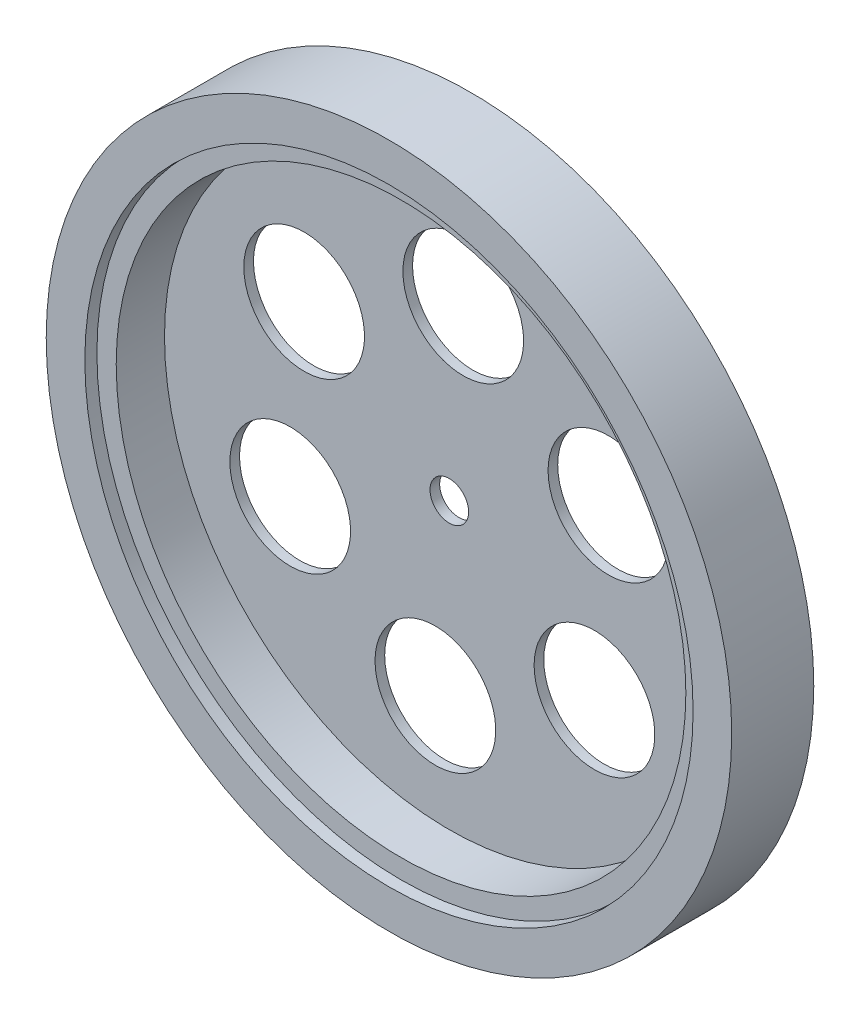
from build123d import *

# Parameters (mm, degrees)
SKETCH1_R                = 33
SKETCH1_R_2              = 29.5
BOSS_EXTRUDE1_DEPTH      = 6
SKETCH2_R                = 33
SKETCH2_R_2              = 2
BOSS_EXTRUDE2_DEPTH      = 1
SKETCH3_R                = 6.25
CUT_EXTRUDE2_DEPTH       = 7
CIRPATTERN1_COUNT        = 6
BOSS_EXTRUDE3_DEPTH      = 1.25
BOSS_EXTRUDE3_DEPTH_BACK = 7.25
SKETCH4_R                = 35.5
SKETCH4_R_2              = 31.5


with BuildPart() as part:
    # Sketch1 → Boss-Extrude1 (new body)
    with BuildSketch(Plane.XY):
        Circle(SKETCH1_R)
        Circle(SKETCH1_R_2, mode=Mode.SUBTRACT)
    extrude(amount=BOSS_EXTRUDE1_DEPTH)

    # Sketch2 → Boss-Extrude2 (add)
    with BuildSketch(Plane(origin=(0, 0, 0), x_dir=(-1, 0, 0), z_dir=(0, 0, -1))):
        with Locations(Location((0, 0, 0), (0, 0, 180))):
            Circle(SKETCH2_R)
        Circle(SKETCH2_R_2, mode=Mode.SUBTRACT)
    extrude(amount=-BOSS_EXTRUDE2_DEPTH)

    # Sketch3 → Cut-Extrude2 (cut)
    with BuildSketch(Plane(origin=(0, 0, 0), x_dir=(-1, 0, 0), z_dir=(0, 0, -1))):
        with Locations((1.444237573, -18.192764436)):
            Circle(SKETCH3_R)
    cut_extrude2 = extrude(amount=-CUT_EXTRUDE2_DEPTH, mode=Mode.SUBTRACT)

    # CirPattern1: Cut-Extrude2 ×6 about axis
    cirpattern1_axis = Axis((0, 0, 0), (0, 0, 1))
    for i in range(1, CIRPATTERN1_COUNT):
        add(cut_extrude2.rotate(cirpattern1_axis, i * 360 / CIRPATTERN1_COUNT), mode=Mode.SUBTRACT)

    # Sketch4 → Boss-Extrude3 (add, two sides: drawn at the far end of the back side and taken through both)
    with BuildSketch(Plane(origin=(0, 0, 0), x_dir=(-1, 0, 0), z_dir=(0, 0, -1)).offset(-BOSS_EXTRUDE3_DEPTH_BACK)):
        Circle(SKETCH4_R)
        with Locations(Location((0, 0, 0), (0, 0, 180))):
            Circle(SKETCH4_R_2, mode=Mode.SUBTRACT)
    extrude(amount=BOSS_EXTRUDE3_DEPTH + BOSS_EXTRUDE3_DEPTH_BACK)


solid = part.part
